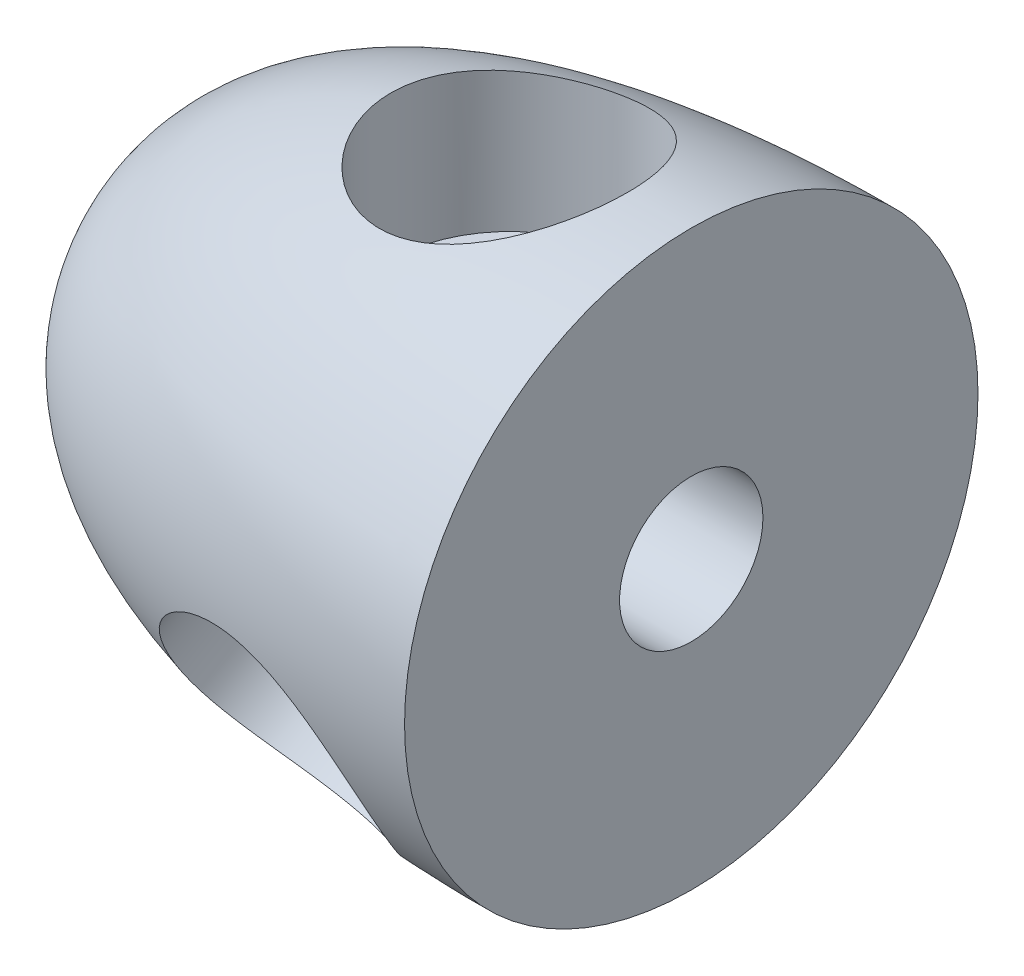
from build123d import *

# Parameters (mm, degrees)
SKETCH2_R          = 5
CUT_EXTRUDE1_DEPTH = 12.7
SKETCH3_R          = 8.25
CUT_EXTRUDE2_DEPTH = 52.419937935
CIRPATTERN1_COUNT  = 3


with BuildPart() as part:
    # Sketch1 → Revolve1 (revolve)
    with BuildSketch(Plane.XY):
        with BuildLine():
            Line((0, 20), (0, 0))
            Line((0, 0), (-38.5, 0))
            add(Edge.make_bspline(
                [(-38.5, 0), (-38.5, 17.416386275), (-14.46163507, 20), (0, 20)],
                knots=[0, 0, 0, 0, 1, 1, 1, 1], degree=3))
        make_face()
    revolve(axis=Axis((0, 0, 0), (-1, 0, 0)))

    # Sketch2 → Cut-Extrude1 (cut)
    with BuildSketch(Plane(origin=(0, 0, 0), x_dir=(0, 0, -1), z_dir=(1, 0, 0))):
        Circle(SKETCH2_R)
    extrude(amount=-CUT_EXTRUDE1_DEPTH, mode=Mode.SUBTRACT)

    # Sketch3 → Cut-Extrude2 (cut, through all)
    with BuildSketch(Plane(origin=(0, 7.6, 0), x_dir=(1, 0, 0), z_dir=(0, 1, 0))):
        with Locations((-12.7, 0)):
            Circle(SKETCH3_R)
    cut_extrude2 = extrude(amount=CUT_EXTRUDE2_DEPTH, mode=Mode.SUBTRACT)

    # CirPattern1: Cut-Extrude2 ×3 about axis
    cirpattern1_axis = Axis((0, 0, 0), (1, 0, 0))
    for i in range(1, CIRPATTERN1_COUNT):
        add(cut_extrude2.rotate(cirpattern1_axis, i * 360 / CIRPATTERN1_COUNT), mode=Mode.SUBTRACT)


solid = part.part
